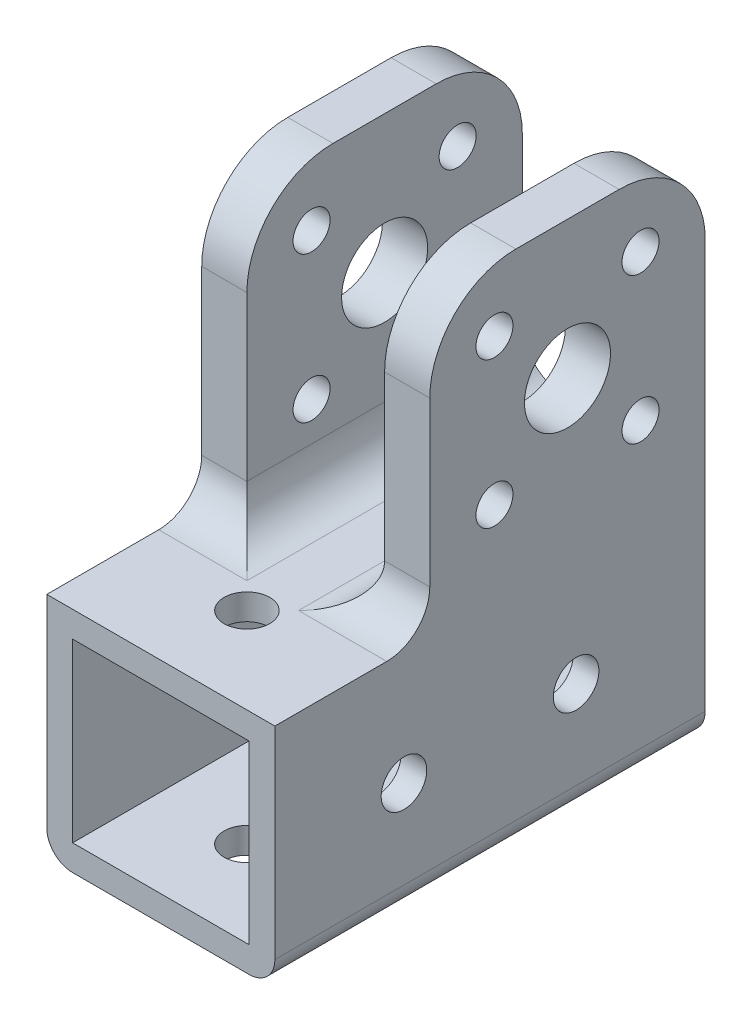
from build123d import *

# Parameters (mm, degrees)
SKETCH_1_W          = 26.5
SKETCH_1_H          = 26.5
SKETCH_1_W_2        = 20.5
SKETCH_1_H_2        = 20.5
EXTRUDE_1_DEPTH     = 50
SKETCH_2_W          = 5.25
SKETCH_2_H          = 32
EXTRUDE_6_DEPTH     = 34
SKETCH_6_R          = 4.5
SKETCH_6_R_2        = 2.15
CUT_EXTRUDE_4_DEPTH = 74.72118081
FILLET_4_R          = 5
FILLET_7_R          = 10
FILLET_8_R          = 10
FILLET_9_R          = 3
SKETCH_7_R          = 2.65
CUT_EXTRUDE_5_DEPTH = 62.899616315
SKETCH_8_R          = 2.65
CUT_EXTRUDE_6_DEPTH = 74.72118081
SKETCH_9_R          = 5
CUT_EXTRUDE_7_DEPTH = 74.72118081


with BuildPart() as part:
    # 草图1 → 凸台-拉伸1 (new body)
    with BuildSketch(Plane.XY):
        Rectangle(SKETCH_1_W, SKETCH_1_H)
        Rectangle(SKETCH_1_W_2, SKETCH_1_H_2, mode=Mode.SUBTRACT)
    extrude(amount=EXTRUDE_1_DEPTH)

    # 草图2 → 凸台-拉伸6 (add)
    with BuildSketch(Plane(origin=(0, 13.25, 0), x_dir=(1, 0, 0), z_dir=(0, 1, 0))):
        with Locations((-10.625, -16)):
            Rectangle(SKETCH_2_W, SKETCH_2_H)
        with Locations((10.625, -16)):
            Rectangle(SKETCH_2_W, SKETCH_2_H)
    extrude(amount=EXTRUDE_6_DEPTH)

    # 草图6 → 切除-拉伸4 (cut, through all)
    with BuildSketch(Plane.ZY.offset(13.25)):
        with Locations((16, 31.25)):
            Circle(SKETCH_6_R)
        with Locations((7.514718626, 39.735281374)):
            Circle(SKETCH_6_R_2)
        with Locations((24.485281374, 39.735281374)):
            Circle(SKETCH_6_R_2)
        with Locations((24.485281374, 22.764718626)):
            Circle(SKETCH_6_R_2)
        with Locations((7.514718626, 22.764718626)):
            Circle(SKETCH_6_R_2)
    extrude(amount=-CUT_EXTRUDE_4_DEPTH, mode=Mode.SUBTRACT)

    # 圆角4
    fillet_4_edges = [part.edges().sort_by_distance(p)[0] for p in [
        (-8, 13.25, 16),
        (-10.625, 13.25, 32),
        (10.625, 13.25, 32),
        (8, 13.25, 16),
    ]]
    fillet(fillet_4_edges, radius=FILLET_4_R)

    # 圆角7
    fillet_7_edges = [part.edges().sort_by_distance(p)[0] for p in [
        (-10.625, 47.25, 0),
        (10.625, 47.25, 0),
    ]]
    fillet(fillet_7_edges, radius=FILLET_7_R)

    # 圆角8
    fillet_8_edges = [part.edges().sort_by_distance(p)[0] for p in [
        (-10.625, 47.25, 32),
        (10.625, 47.25, 32),
    ]]
    fillet(fillet_8_edges, radius=FILLET_8_R)

    # 圆角9
    fillet_9_edges = [part.edges().sort_by_distance(p)[0] for p in [
        (13.25, -13.25, 25),
        (-13.25, -13.25, 25),
    ]]
    fillet(fillet_9_edges, radius=FILLET_9_R)

    # 草图7 → 切除-拉伸5 (cut, through all)
    with BuildSketch(Plane(origin=(0, 13.25, 0), x_dir=(1, 0, 0), z_dir=(0, 1, 0))):
        with Locations(Location((0, -40, 0), (0, 0, 270))):
            Circle(SKETCH_7_R)
    extrude(amount=-CUT_EXTRUDE_5_DEPTH, mode=Mode.SUBTRACT)

    # 草图8 → 切除-拉伸6 (cut, through all)
    with BuildSketch(Plane.ZY.offset(13.25)):
        with Locations((35, 0)):
            Circle(SKETCH_8_R)
        with Locations((15, 0)):
            Circle(SKETCH_8_R)
    extrude(amount=-CUT_EXTRUDE_6_DEPTH, mode=Mode.SUBTRACT)

    # 草图9 → 切除-拉伸7 (cut, through all)
    with BuildSketch(Plane(origin=(13.25, 0, 0), x_dir=(0, 0, -1), z_dir=(1, 0, 0))):
        with Locations(Location((-16, 31.25, 0), (0, 0, 90))):
            Circle(SKETCH_9_R)
    extrude(amount=-CUT_EXTRUDE_7_DEPTH, mode=Mode.SUBTRACT)


solid = part.part
